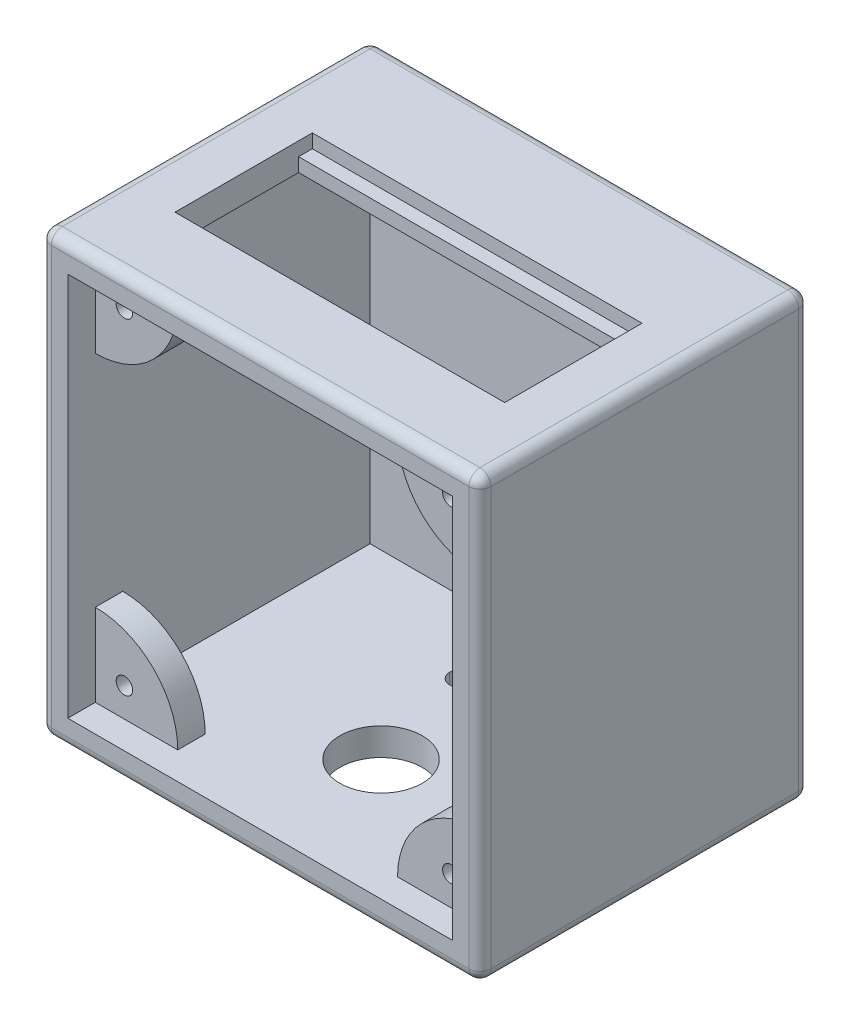
from build123d import *

# Parameters (mm, degrees)
SKETCH_1_W          = 80
SKETCH_1_H          = 80
EXTRUDE_2_DEPTH     = 60
SKETCH_2_W          = 70
SKETCH_2_H          = 70
CUT_EXTRUDE_1_DEPTH = 55
EXTRUDE_3_DEPTH     = 10
EXTRUDE_3_2_DEPTH   = 10
EXTRUDE_3_3_DEPTH   = 10
EXTRUDE_3_4_DEPTH   = 10
CUT_EXTRUDE_2_DEPTH = 5
SKETCH_6_R          = 1.5
CUT_EXTRUDE_3_DEPTH = 5
CUT_EXTRUDE_4_DEPTH = 5
FILLET_1_R          = 2
FILLET_2_R          = 2
FILLET_3_R          = 2
FILLET_4_R          = 2
SKETCH_10_R         = 7.5
CUT_EXTRUDE_5_DEPTH = 5
SKETCH_11_W         = 60
SKETCH_11_H         = 20
CUT_EXTRUDE_6_DEPTH = 5
SKETCH_12_W         = 60
SKETCH_12_H         = 2.5
CUT_EXTRUDE_9_DEPTH = 2.5


with BuildPart() as part:
    # Эскиз1 → Бобышка-Вытянуть2 (new body)
    with BuildSketch(Plane.XY):
        Rectangle(SKETCH_1_W, SKETCH_1_H)
    extrude(amount=EXTRUDE_2_DEPTH)

    # Эскиз2 → Вырез-Вытянуть1 (cut)
    with BuildSketch(Plane.XY.offset(60)):
        Rectangle(SKETCH_2_W, SKETCH_2_H)
    extrude(amount=-CUT_EXTRUDE_1_DEPTH, mode=Mode.SUBTRACT)

    # Эскиз7 → Вырез-Вытянуть4 (cut)
    with BuildSketch(Plane.XZ.offset(40)):
        with BuildLine():
            Line((5.5, 20), (-5.5, 20))
            ThreePointArc((-5.5, 20), (-6.914213562, 19.414213562), (-7.5, 18))
            Line((-7.5, 18), (-7.5, 12))
            ThreePointArc((-7.5, 12), (-6.914213562, 10.585786438), (-5.5, 10))
            Line((-5.5, 10), (5.5, 10))
            ThreePointArc((5.5, 10), (6.914213562, 10.585786438), (7.5, 12))
            Line((7.5, 12), (7.5, 18))
            ThreePointArc((7.5, 18), (6.914213562, 19.414213562), (5.5, 20))
        make_face()
    extrude(amount=-CUT_EXTRUDE_4_DEPTH, mode=Mode.SUBTRACT)

    # Скругление1
    fillet_1_edges = [part.edges().sort_by_distance(p)[0] for p in [
        (40, -40, 30),
        (-40, -40, 30),
    ]]
    fillet(fillet_1_edges, radius=FILLET_1_R)

    # Скругление2
    fillet_2_edges = [part.edges().sort_by_distance(p)[0] for p in [
        (-40, 40, 30),
        (40, 40, 30),
    ]]
    fillet(fillet_2_edges, radius=FILLET_2_R)

    # Скругление3
    fillet_3_edges = [part.edges().sort_by_distance(p)[0] for p in [
        (40, 0, 60),
        (0, -40, 60),
        (-39.414213562, -39.414213562, 60),
        (39.414213562, -39.414213562, 60),
        (-40, 0, 60),
        (0, 40, 60),
        (39.414213562, 39.414213562, 60),
        (-39.414213562, 39.414213562, 60),
    ]]
    fillet(fillet_3_edges, radius=FILLET_3_R)

    # Скругление4
    fillet_4_edges = [part.edges().sort_by_distance(p)[0] for p in [
        (40, 0, 0),
        (0, -40, 0),
        (-39.414213562, -39.414213562, 0),
        (39.414213562, -39.414213562, 0),
        (-40, 0, 0),
        (0, 40, 0),
        (39.414213562, 39.414213562, 0),
        (-39.414213562, 39.414213562, 0),
    ]]
    fillet(fillet_4_edges, radius=FILLET_4_R)

    # Эскиз10 → Вырез-Вытянуть5 (cut)
    with BuildSketch(Plane.XZ.offset(40)):
        with Locations((0, 38)):
            Circle(SKETCH_10_R)
    extrude(amount=-CUT_EXTRUDE_5_DEPTH, mode=Mode.SUBTRACT)

    # Эскиз11 → Вырез-Вытянуть6 (cut)
    with BuildSketch(Plane(origin=(0, 40, 0), x_dir=(1, 0, 0), z_dir=(0, 1, 0))):
        with Locations((0, -33)):
            Rectangle(SKETCH_11_W, SKETCH_11_H)
    extrude(amount=-CUT_EXTRUDE_6_DEPTH, mode=Mode.SUBTRACT)

    # Эскиз12 → Вырез-Вытянуть9 (cut)
    with BuildSketch(Plane(origin=(0, 40, 0), x_dir=(1, 0, 0), z_dir=(0, 1, 0))):
        with Locations((0, -21.75)):
            Rectangle(SKETCH_12_W, SKETCH_12_H)
        with Locations((0, -44.25)):
            Rectangle(SKETCH_12_W, SKETCH_12_H)
    extrude(amount=-CUT_EXTRUDE_9_DEPTH, mode=Mode.SUBTRACT)


with BuildPart() as body_2:
    # Эскиз3 → Бобышка-Вытянуть3 (new body)
    with BuildSketch(Plane.XY.offset(60)):
        with BuildLine():
            Line((-35, 35), (-35, 20))
            ThreePointArc((-35, 20), (-24.393398282, 24.393398282), (-20, 35))
            Line((-20, 35), (-35, 35))
        make_face()
    extrude(amount=-EXTRUDE_3_DEPTH)


with BuildPart() as body_3:
    # Эскиз3 → Extrude 3 2 (new body)
    with BuildSketch(Plane.XY.offset(60)):
        with BuildLine():
            Line((35, 35), (35, 20))
            ThreePointArc((35, 20), (24.393398282, 24.393398282), (20, 35))
            Line((20, 35), (35, 35))
        make_face()
    extrude(amount=-EXTRUDE_3_2_DEPTH)


with BuildPart() as body_4:
    # Эскиз3 → Extrude 3 3 (new body)
    with BuildSketch(Plane.XY.offset(60)):
        with BuildLine():
            Line((20, -35), (35, -35))
            Line((35, -35), (35, -20))
            ThreePointArc((35, -20), (24.393398282, -24.393398282), (20, -35))
        make_face()
    extrude(amount=-EXTRUDE_3_3_DEPTH)


with BuildPart() as body_5:
    # Эскиз3 → Extrude 3 4 (new body)
    with BuildSketch(Plane.XY.offset(60)):
        with BuildLine():
            Line((-35, -20), (-35, -35))
            Line((-35, -35), (-20, -35))
            ThreePointArc((-20, -35), (-24.393398282, -24.393398282), (-35, -20))
        make_face()
    extrude(amount=-EXTRUDE_3_4_DEPTH)


with BuildPart() as cut_extrude_2_tool:
    # Эскиз5 → Вырез-Вытянуть2 (new body)
    with BuildSketch(Plane.XY.offset(60)):
        with BuildLine():
            Line((-35, 35), (-20, 35))
            ThreePointArc((-20, 35), (-24.393398282, 24.393398282), (-35, 20))
            Line((-35, 20), (-35, 35))
        make_face()
        with BuildLine():
            Line((35, 35), (35, 20))
            ThreePointArc((35, 20), (24.393398282, 24.393398282), (20, 35))
            Line((20, 35), (35, 35))
        make_face()
        with BuildLine():
            Line((35, -20), (35, -35))
            Line((35, -35), (20, -35))
            ThreePointArc((20, -35), (24.393398282, -24.393398282), (35, -20))
        make_face()
        with BuildLine():
            Line((-20, -35), (-35, -35))
            Line((-35, -35), (-35, -20))
            ThreePointArc((-35, -20), (-24.393398282, -24.393398282), (-20, -35))
        make_face()
    extrude(amount=-CUT_EXTRUDE_2_DEPTH)


with BuildPart() as body_2_1:
    add(body_2.part)

    # Вырез-Вытянуть2: cut by cut_extrude_2_tool
    add(cut_extrude_2_tool.part, mode=Mode.SUBTRACT)


with BuildPart() as body_3_1:
    add(body_3.part)

    # Вырез-Вытянуть2: cut by cut_extrude_2_tool
    add(cut_extrude_2_tool.part, mode=Mode.SUBTRACT)


with BuildPart() as body_4_1:
    add(body_4.part)

    # Вырез-Вытянуть2: cut by cut_extrude_2_tool
    add(cut_extrude_2_tool.part, mode=Mode.SUBTRACT)


with BuildPart() as body_5_1:
    add(body_5.part)

    # Вырез-Вытянуть2: cut by cut_extrude_2_tool
    add(cut_extrude_2_tool.part, mode=Mode.SUBTRACT)


with BuildPart() as cut_extrude_3_tool:
    # Эскиз6 → Вырез-Вытянуть3 (new body)
    with BuildSketch(Plane.XY.offset(55)):
        with Locations((-29.696699141, 29.696699141)):
            Circle(SKETCH_6_R)
        with Locations((29.696699141, 29.696699141)):
            Circle(SKETCH_6_R)
        with Locations(Location((29.696699141, -29.696699141, 0), (0, 0, 180))):
            Circle(SKETCH_6_R)
        with Locations(Location((-29.696699141, -29.696699141, 0), (0, 0, 180))):
            Circle(SKETCH_6_R)
    extrude(amount=-CUT_EXTRUDE_3_DEPTH)


with BuildPart() as body_2_2:
    add(body_2_1.part)

    # Вырез-Вытянуть3: cut by cut_extrude_3_tool
    add(cut_extrude_3_tool.part, mode=Mode.SUBTRACT)


with BuildPart() as body_3_2:
    add(body_3_1.part)

    # Вырез-Вытянуть3: cut by cut_extrude_3_tool
    add(cut_extrude_3_tool.part, mode=Mode.SUBTRACT)


with BuildPart() as body_4_2:
    add(body_4_1.part)

    # Вырез-Вытянуть3: cut by cut_extrude_3_tool
    add(cut_extrude_3_tool.part, mode=Mode.SUBTRACT)


with BuildPart() as body_5_2:
    add(body_5_1.part)

    # Вырез-Вытянуть3: cut by cut_extrude_3_tool
    add(cut_extrude_3_tool.part, mode=Mode.SUBTRACT)


solid = Compound([part.part, body_2_2.part, body_3_2.part, body_4_2.part, body_5_2.part])
